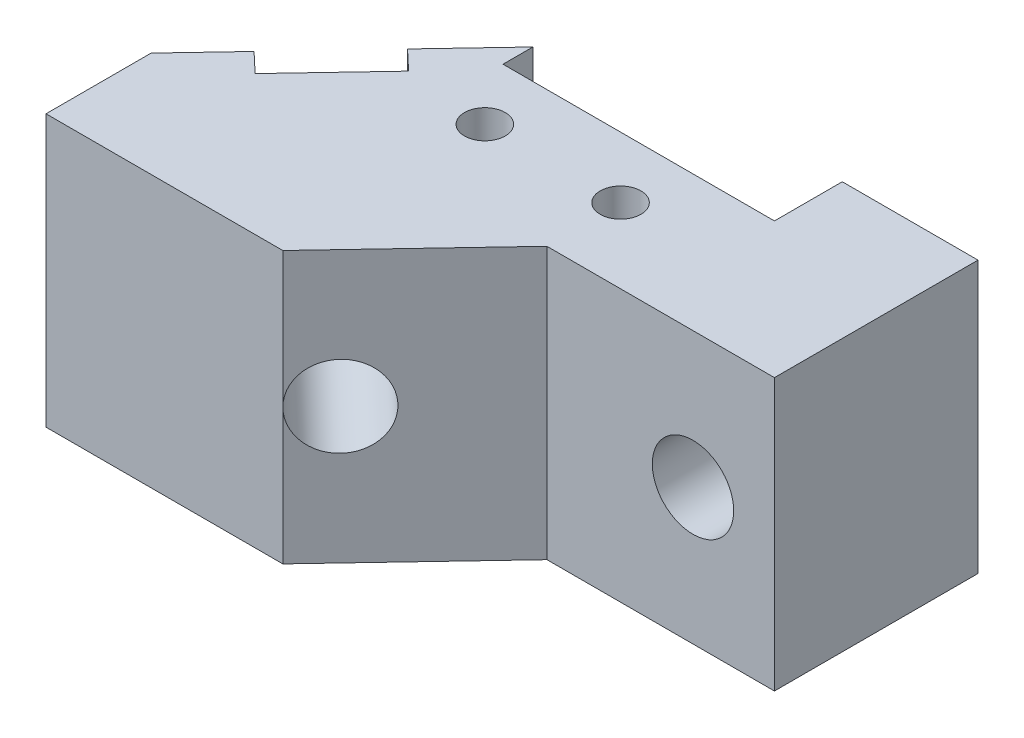
from build123d import *

# Parameters (mm, degrees)
EXTRUDE_1_DEPTH     = 20
SKETCH_3_R          = 3
CUT_EXTRUDE_1_DEPTH = 50.44085347
SKETCH_4_R          = 3
CUT_EXTRUDE_2_DEPTH = 13
SKETCH_5_W          = 10
SKETCH_5_H          = 10
CUT_EXTRUDE_3_DEPTH = 42.500069294
EXTRUDE_START       = -3
SKETCH_6_R          = 3
SKETCH_6_R_2        = 1
EXTRUDE_2_DEPTH     = 3
CUT_EXTRUDE_4_DEPTH = 44.06045332
SKETCH_8_W          = 11.012061463
SKETCH_8_H          = 5
CUT_EXTRUDE_5_DEPTH = 5
CUT_EXTRUDE_6_DEPTH = 59.475618781
SKETCH_10_R         = 1.5
CUT_EXTRUDE_7_DEPTH = 59.475618781


with BuildPart() as part:
    # Эскиз2 → Бобышка-Вытянуть1 (new body)
    with BuildSketch(Plane(origin=(0, 0, 0), x_dir=(1, 0, 0), z_dir=(0, 1, 0))):
        Polygon((-37.674898697, 15), (-20.223748416, 15), (-10.76484276, 25), (6, 25), (6, 40), (-37.674898697, 40), align=None)
    extrude(amount=EXTRUDE_1_DEPTH)

    # Эскиз3 → Вырез-Вытянуть1 (cut, through all)
    with BuildSketch(Plane(origin=(0, 0, -40), x_dir=(-1, 0, 0), z_dir=(0, 0, -1))):
        with Locations((0, 10)):
            Circle(SKETCH_3_R)
    extrude(amount=-CUT_EXTRUDE_1_DEPTH, mode=Mode.SUBTRACT)

    # Эскиз4 → Вырез-Вытянуть2 (cut)
    with BuildSketch(Plane(origin=(-18.162212555, 0, -17.179465507), x_dir=(0.6871786202657265, 0, -0.7264885022143794), z_dir=(0.7264885022143794, 0, 0.6871786202657265))):
        with Locations((0, 10)):
            Circle(SKETCH_4_R)
    extrude(amount=-CUT_EXTRUDE_2_DEPTH, mode=Mode.SUBTRACT)

    # Эскиз5 → Вырез-Вытянуть3 (cut, through all)
    with BuildSketch(Plane(origin=(-27.606563084, 0, -26.11278757), x_dir=(0.6871786202657265, 0, -0.7264885022143796), z_dir=(0.7264885022143796, 0, 0.6871786202657265))):
        with Locations((0, 10)):
            Rectangle(SKETCH_5_W, SKETCH_5_H)
    extrude(amount=-CUT_EXTRUDE_3_DEPTH, mode=Mode.SUBTRACT)

    # Эскиз6 → Бобышка-Вытянуть2 (add)
    with BuildSketch(Plane(origin=(-27.606563084, 0, -26.11278757), x_dir=(-0.6871786202657266, 0, 0.7264885022143793), z_dir=(-0.7264885022143793, 0, -0.6871786202657266)).offset(EXTRUDE_START)):
        with Locations((0, 10)):
            Circle(SKETCH_6_R)
        with Locations((0, 10)):
            Circle(SKETCH_6_R_2, mode=Mode.SUBTRACT)
    extrude(amount=EXTRUDE_2_DEPTH)

    # Эскиз7 → Вырез-Вытянуть4 (cut, through all)
    with BuildSketch(Plane(origin=(-29.786028591, 0, -28.174323431), x_dir=(-0.6871786202657266, 0, 0.7264885022143793), z_dir=(-0.7264885022143793, 0, -0.6871786202657266))):
        Polygon((-5, 5), (-5, 15), (-4, 15), (-4, 20), (-3.170155184, 20), (4, 20), (4, 15), (5, 15), (5, 5), (4, 5), (4, 0), (-3.170155184, 0), (-4, 0), (-4, 5), align=None)
    extrude(amount=CUT_EXTRUDE_4_DEPTH, mode=Mode.SUBTRACT)

    # Эскиз8 → Вырез-Вытянуть5 (cut)
    with BuildSketch(Plane(origin=(0, 0, -40), x_dir=(-1, 0, 0), z_dir=(0, 0, -1))):
        with Locations((29.506030732, 10)):
            Rectangle(SKETCH_8_W, SKETCH_8_H)
        Polygon((4, 20), (4, 0), (24, 0), (24, 7.5), (24, 12.5), (24, 20), align=None)
    extrude(amount=-CUT_EXTRUDE_5_DEPTH, mode=Mode.SUBTRACT)

    # Эскиз9 → Вырез-Вытянуть6 (cut, through all)
    with BuildSketch(Plane(origin=(0, 20, 0), x_dir=(1, 0, 0), z_dir=(0, 1, 0))):
        Polygon((-24, 37.20179178), (-37.674898697, 22.744623907), (-37.674898697, 40), (-24, 40), align=None)
    extrude(amount=-CUT_EXTRUDE_6_DEPTH, mode=Mode.SUBTRACT)

    # Эскиз10 → Вырез-Вытянуть7 (cut, through all)
    with BuildSketch(Plane(origin=(0, 20, 0), x_dir=(1, 0, 0), z_dir=(0, 1, 0))):
        with Locations(Location((-10.837449348, 30.5, 0), (0, 0, 270))):
            Circle(SKETCH_10_R)
        with Locations(Location((-20.837449348, 30.5, 0), (0, 0, 90))):
            Circle(SKETCH_10_R)
    extrude(amount=-CUT_EXTRUDE_7_DEPTH, mode=Mode.SUBTRACT)


solid = part.part
